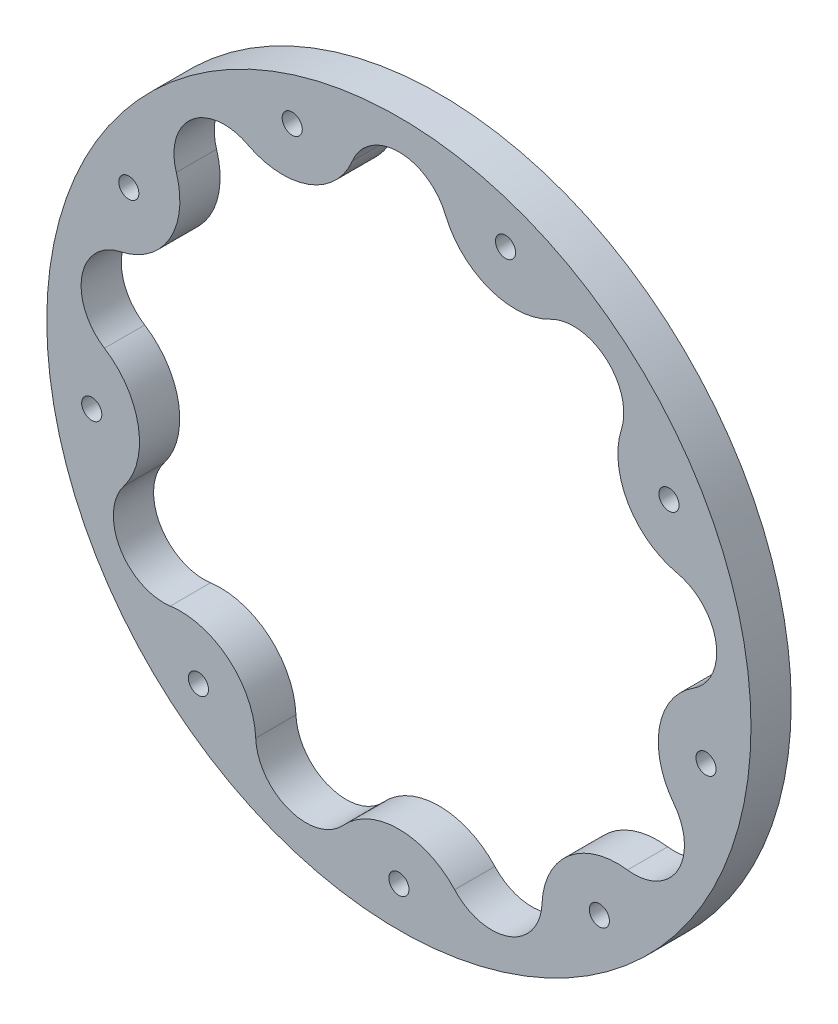
from build123d import *

# Parameters (mm, degrees)
SKETCH_1_R          = 70
EXTRUDE_1_DEPTH     = 8
CUT_EXTRUDE_1_DEPTH = 8
SKETCH_3_R          = 2
CUT_EXTRUDE_2_DEPTH = 8


with BuildPart() as part:
    # 草图1 → 凸台-拉伸1 (new body)
    with BuildSketch(Plane.XY):
        Circle(SKETCH_1_R)
    extrude(amount=EXTRUDE_1_DEPTH)

    # 草图2 → 切除-拉伸1 (cut)
    with BuildSketch(Plane.XY.offset(8)):
        with BuildLine():
            ThreePointArc((9.24720137, 57.806476957), (0, 64), (-9.24720137, 57.806476957))
            ThreePointArc((-9.24720137, 57.806476957), (-17.987701275, 49.420803081), (-30.073519924, 50.226316914))
            ThreePointArc((-30.073519924, 50.226316914), (-41.13840702, 49.02684436), (-44.241054371, 38.338343984))
            ThreePointArc((-44.241054371, 38.338343984), (-45.546458487, 26.296260068), (-55.322507015, 19.144704984))
            ThreePointArc((-55.322507015, 19.144704984), (-63.027696193, 11.113483371), (-58.534026348, 0.931273778))
            ThreePointArc((-58.534026348, 0.931273778), (-51.793521581, -9.132595281), (-54.685478233, -20.894927178))
            ThreePointArc((-54.685478233, -20.894927178), (-55.425625842, -32), (-45.438276863, -36.911549779))
            ThreePointArc((-45.438276863, -36.911549779), (-33.805820306, -40.2882078), (-28.460506424, -51.157590692))
            ThreePointArc((-28.460506424, -51.157590692), (-21.889289173, -60.14032773), (-11.081452644, -57.483048968))
            ThreePointArc((-11.081452644, -57.483048968), (0, -52.592520136), (11.081452644, -57.483048968))
            ThreePointArc((11.081452644, -57.483048968), (21.889289173, -60.14032773), (28.460506424, -51.157590692))
            ThreePointArc((28.460506424, -51.157590692), (33.805820306, -40.2882078), (45.438276863, -36.911549779))
            ThreePointArc((45.438276863, -36.911549779), (55.425625842, -32), (54.685478233, -20.894927178))
            ThreePointArc((54.685478233, -20.894927178), (51.793521581, -9.132595281), (58.534026348, 0.931273778))
            ThreePointArc((58.534026348, 0.931273778), (63.027696193, 11.113483371), (55.322507015, 19.144704984))
            ThreePointArc((55.322507015, 19.144704984), (45.546458487, 26.296260068), (44.241054371, 38.338343984))
            ThreePointArc((44.241054371, 38.338343984), (41.13840702, 49.02684436), (30.073519924, 50.226316914))
            ThreePointArc((30.073519924, 50.226316914), (17.987701275, 49.420803081), (9.24720137, 57.806476957))
        make_face()
    extrude(amount=-CUT_EXTRUDE_1_DEPTH, mode=Mode.SUBTRACT)

    # 草图3 → 切除-拉伸2 (cut)
    with BuildSketch(Plane(origin=(0, 0, 0), x_dir=(-1, 0, 0), z_dir=(0, 0, -1))):
        with Locations((21.205248886, 58.260942489)):
            Circle(SKETCH_3_R)
        with Locations((53.693575035, 31)):
            Circle(SKETCH_3_R)
        with Locations((61.058080687, -10.766187015)):
            Circle(SKETCH_3_R)
        with Locations((39.852831801, -47.494755473)):
            Circle(SKETCH_3_R)
        with Locations((0, -62)):
            Circle(SKETCH_3_R)
        with Locations((-39.852831801, -47.494755473)):
            Circle(SKETCH_3_R)
        with Locations((-61.058080687, -10.766187015)):
            Circle(SKETCH_3_R)
        with Locations((-53.693575035, 31)):
            Circle(SKETCH_3_R)
        with Locations((-21.205248886, 58.260942489)):
            Circle(SKETCH_3_R)
    extrude(amount=-CUT_EXTRUDE_2_DEPTH, mode=Mode.SUBTRACT)


solid = part.part
